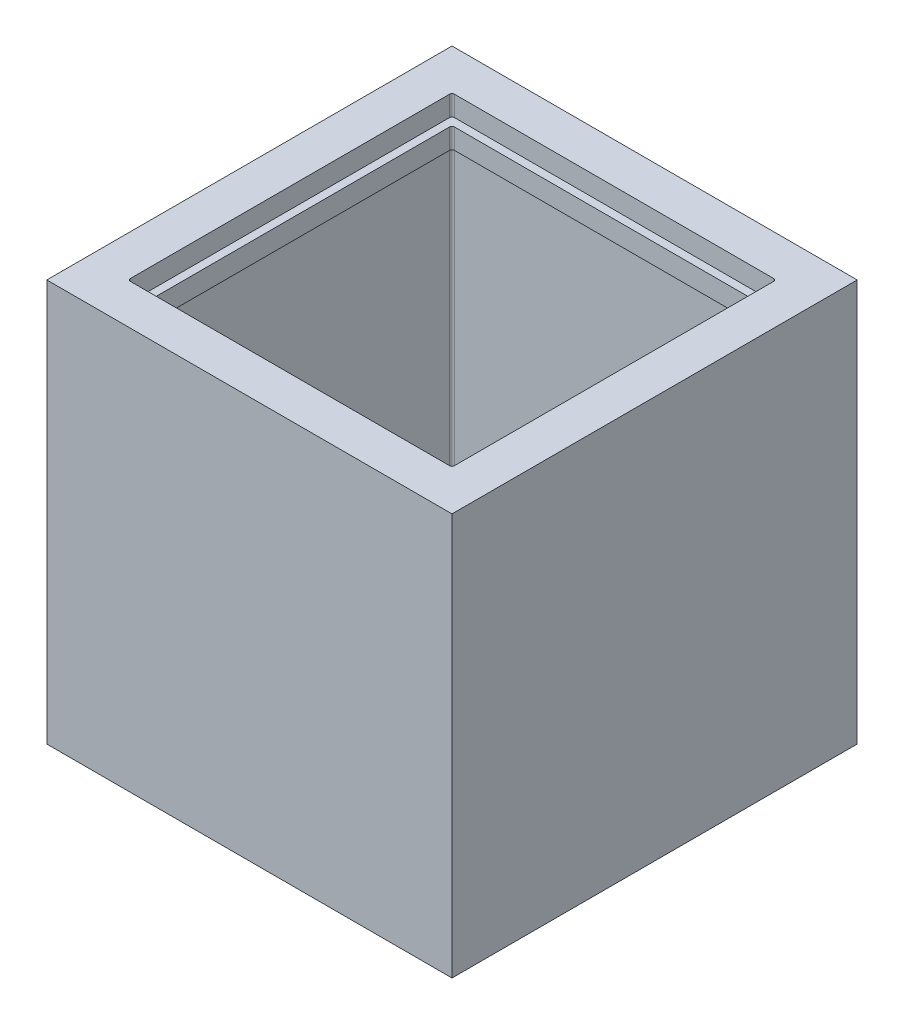
from build123d import *

# Parameters (mm, degrees)
SKETCH1_W           = 127
SKETCH1_H           = 127
BOSS_EXTRUDE1_DEPTH = 127
SKETCH2_W           = 96.52
SKETCH2_H           = 96.52
CUT_EXTRUDE1_DEPTH  = 118.11
SKETCH3_W           = 101.6
SKETCH3_H           = 101.6
SKETCH3_W_2         = 96.52
SKETCH3_H_2         = 96.52
CUT_EXTRUDE2_DEPTH  = 6.35
SKETCH5_W           = 96.52
SKETCH5_H           = 105.41
CUT_EXTRUDE3_DEPTH  = 6.35
SKETCH6_W           = 109.22
SKETCH6_H           = 105.41
CUT_EXTRUDE4_DEPTH  = 6.35
CHAMFER1_SIZE       = 1.016
FILLET2_R           = 0.762
FILLET3_R           = 0.762
FILLET4_R           = 0.762


with BuildPart() as part:
    # Sketch1 → Boss-Extrude1 (new body)
    with BuildSketch(Plane.XY):
        Rectangle(SKETCH1_W, SKETCH1_H)
    extrude(amount=BOSS_EXTRUDE1_DEPTH)

    # Sketch2 → Cut-Extrude1 (cut)
    with BuildSketch(Plane(origin=(0, 63.5, 0), x_dir=(1, 0, 0), z_dir=(0, 1, 0))):
        with Locations((0, -63.5)):
            Rectangle(SKETCH2_W, SKETCH2_H)
    extrude(amount=-CUT_EXTRUDE1_DEPTH, mode=Mode.SUBTRACT)

    # Sketch3 → Cut-Extrude2 (cut)
    with BuildSketch(Plane(origin=(0, 63.5, 0), x_dir=(1, 0, 0), z_dir=(0, 1, 0))):
        with Locations((0, -63.5)):
            Rectangle(SKETCH3_W, SKETCH3_H)
        with Locations((0, -63.5)):
            Rectangle(SKETCH3_W_2, SKETCH3_H_2, mode=Mode.SUBTRACT)
    extrude(amount=-CUT_EXTRUDE2_DEPTH, mode=Mode.SUBTRACT)

    # Sketch5 → Cut-Extrude3 (cut)
    with BuildSketch(Plane.XY.offset(15.24)):
        with Locations((0, -1.905)):
            Rectangle(SKETCH5_W, SKETCH5_H)
    cut_extrude3 = extrude(amount=-CUT_EXTRUDE3_DEPTH, mode=Mode.SUBTRACT)

    # Mirror1: Cut-Extrude3 across plane
    add(cut_extrude3.mirror(Plane(origin=(0, 0, 63.5), x_dir=(1, 0, 0), z_dir=(0, 0, -1))), mode=Mode.SUBTRACT)

    # Sketch6 → Cut-Extrude4 (cut)
    with BuildSketch(Plane.ZY.offset(-48.26)):
        with Locations((63.5, -1.905)):
            Rectangle(SKETCH6_W, SKETCH6_H)
    cut_extrude4 = extrude(amount=-CUT_EXTRUDE4_DEPTH, mode=Mode.SUBTRACT)

    # Mirror2: Cut-Extrude4 across plane
    add(cut_extrude4.mirror(Plane(origin=(0, 0, 0), x_dir=(0, 0, 1), z_dir=(1, 0, 0))), mode=Mode.SUBTRACT)

    # Chamfer1
    chamfer1_edges = [part.edges().sort_by_distance(p)[0] for p in [
        (0, -63.5, 127),
        (0, -63.5, 0),
        (63.5, -63.5, 63.5),
        (-63.5, -63.5, 63.5),
    ]]
    chamfer(chamfer1_edges, length=CHAMFER1_SIZE)

    # Fillet2
    fillet2_edges = [part.edges().sort_by_distance(p)[0] for p in [
        (54.61, -1.905, 8.89),
        (54.61, -1.905, 118.11),
        (-54.61, -1.905, 8.89),
        (-54.61, -1.905, 118.11),
    ]]
    fillet(fillet2_edges, radius=FILLET2_R)

    # Fillet3
    fillet3_edges = [part.edges().sort_by_distance(p)[0] for p in [
        (-50.8, 60.325, 114.3),
        (-50.8, 60.325, 12.7),
        (50.8, 60.325, 12.7),
        (50.8, 60.325, 114.3),
        (-48.26, 53.975, 15.24),
        (48.26, 53.975, 15.24),
        (48.26, 53.975, 111.76),
        (-48.26, 53.975, 111.76),
    ]]
    fillet(fillet3_edges, radius=FILLET3_R)

    # Fillet4
    fillet4_edges = [part.edges().sort_by_distance(p)[0] for p in [
        (54.61, 50.8, 63.5),
        (-54.61, 50.8, 63.5),
        (0, 50.8, 8.89),
        (0, 50.8, 118.11),
        (-54.386815367, 50.8, 9.113184633),
        (54.386815367, 50.8, 9.113184633),
        (-54.386815367, 50.8, 117.886815367),
        (54.386815367, 50.8, 117.886815367),
    ]]
    fillet(fillet4_edges, radius=FILLET4_R)


solid = part.part
